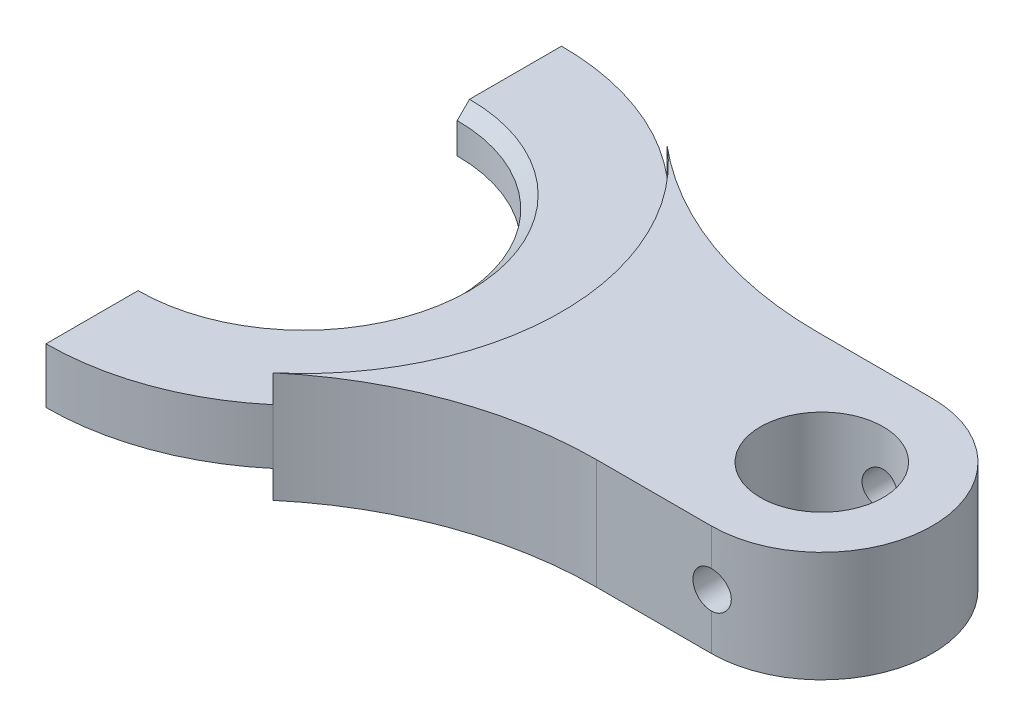
from build123d import *

# Parameters (mm, degrees)
SKETCH_1_R          = 5
EXTRUDE_1_DEPTH     = 4.5
CUT_EXTRUDE_1_DEPTH = 2.25
CHAMFER_1_SIZE      = 1
SKETCH_3_R          = 1.5
CUT_EXTRUDE_2_DEPTH = 16.625


with BuildPart() as part:
    # 草图1 → 凸台-拉伸1 (new, symmetric)
    with BuildSketch(Plane(origin=(0, 0, 0), x_dir=(1, 0, 0), z_dir=(0, 1, 0))):
        with BuildLine():
            Line((0, 9), (-9.33664655, 9))
            ThreePointArc((-9.33664655, 9), (-19.626561658, 10.819906901), (-28.668030932, 16.058823529))
            ThreePointArc((-28.668030932, 16.058823529), (-34.997059424, 19.726065169), (-42.2, 21))
            Line((-42.2, 21), (-42.2, 12.5))
            ThreePointArc((-42.2, 12.5), (-29.7, 0), (-42.2, -12.5))
            Line((-42.2, -12.5), (-42.2, -21))
            ThreePointArc((-42.2, -21), (-34.997059424, -19.726065169), (-28.668030932, -16.058823529))
            ThreePointArc((-28.668030932, -16.058823529), (-19.626561658, -10.819906901), (-9.33664655, -9))
            Line((-9.33664655, -9), (0, -9))
            ThreePointArc((0, -9), (9, 0), (0, 9))
        make_face()
        with Locations(Location((0, 0, 0), (0, 0, 270))):
            Circle(SKETCH_1_R, mode=Mode.SUBTRACT)
    extrude(amount=EXTRUDE_1_DEPTH, both=True)

    # 草图2 → 切除-拉伸1 (cut)
    with BuildSketch(Plane(origin=(0, 4.5, 0), x_dir=(1, 0, 0), z_dir=(0, 1, 0))):
        with BuildLine():
            Line((-42.2, -12.5), (-42.2, -21))
            ThreePointArc((-42.2, -21), (-21.2, 0), (-42.2, 21))
            Line((-42.2, 21), (-42.2, 12.5))
            ThreePointArc((-42.2, 12.5), (-29.7, 0), (-42.2, -12.5))
        make_face()
    cut_extrude_1 = extrude(amount=-CUT_EXTRUDE_1_DEPTH, mode=Mode.SUBTRACT)

    # 镜向1: 切除-拉伸1 across plane
    add(cut_extrude_1.mirror(Plane.ZX), mode=Mode.SUBTRACT)

    # 倒角1
    chamfer_1_edges = [part.edges().sort_by_distance(p)[0] for p in [
        (-29.7, 2.25, 0),
        (-29.7, -2.25, 0),
    ]]
    chamfer(chamfer_1_edges, length=CHAMFER_1_SIZE)

    # 草图3 → 切除-拉伸2 (cut, symmetric)
    with BuildSketch(Plane.XY):
        with Locations(Location((0, 0, 0), (0, 0, 89.999999982))):
            Circle(SKETCH_3_R)
    extrude(amount=CUT_EXTRUDE_2_DEPTH, both=True, mode=Mode.SUBTRACT)


solid = part.part
